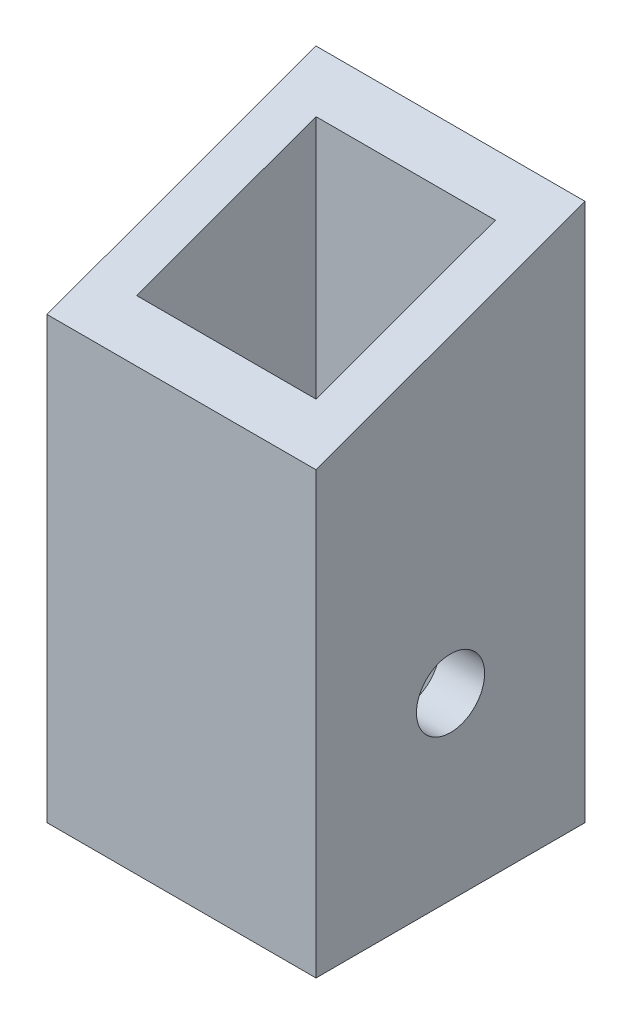
from build123d import *

# Parameters (mm, degrees)
BOSS_EXTRUDE1_DEPTH = 19.05
SKETCH2_W           = 12.7
SKETCH2_H           = 12.7
CUT_EXTRUDE1_DEPTH  = 272.852903886
SKETCH3_R           = 2.413
CUT_EXTRUDE2_DEPTH  = 354.991519469


with BuildPart() as part:
    # Sketch1 → Boss-Extrude1 (new body)
    with BuildSketch(Plane(origin=(0, 0, 0), x_dir=(0, 0, -1), z_dir=(1, 0, 0))):
        Polygon((268.494858146, -191.807817407), (268.494858146, -229.907817407), (249.444858146, -229.907817407), (249.444858146, -198.74145037), align=None)
    extrude(amount=BOSS_EXTRUDE1_DEPTH)

    # Sketch2 → Cut-Extrude1 (cut, through all)
    with BuildSketch(Plane.XZ.offset(229.907817407)):
        with Locations((9.525, -258.969858146)):
            Rectangle(SKETCH2_W, SKETCH2_H)
    extrude(amount=-CUT_EXTRUDE1_DEPTH, mode=Mode.SUBTRACT)

    # Sketch3 → Cut-Extrude2 (cut, through all)
    with BuildSketch(Plane(origin=(19.05, 0, 0), x_dir=(0, 0, -1), z_dir=(1, 0, 0))):
        with Locations((258.969858146, -217.207817407)):
            Circle(SKETCH3_R)
    extrude(amount=-CUT_EXTRUDE2_DEPTH, mode=Mode.SUBTRACT)


solid = part.part
